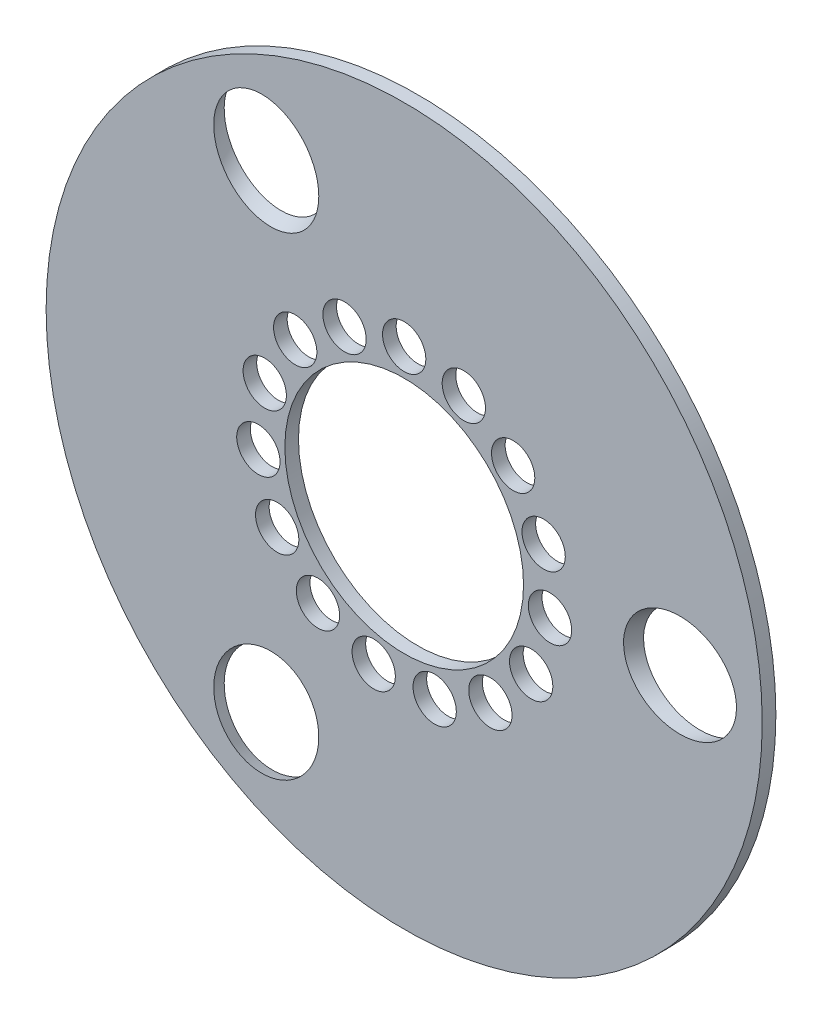
from build123d import *

# Parameters (mm, degrees)
SKETCH1_R           = 52.5
BOSS_EXTRUDE2_DEPTH = 2
SKETCH4_R           = 3.175
CUT_EXTRUDE2_DEPTH  = 2
SKETCH5_R           = 7.5
CUT_EXTRUDE3_DEPTH  = 102
SKETCH6_R           = 7.5
CUT_EXTRUDE4_DEPTH  = 102
SKETCH7_R           = 7.5
CUT_EXTRUDE5_DEPTH  = 102
SKETCH8_R           = 17.5
CUT_EXTRUDE6_DEPTH  = 10


with BuildPart() as part:
    # Sketch1 → Boss-Extrude2 (new body)
    with BuildSketch(Plane.XY):
        Circle(SKETCH1_R)
    extrude(amount=BOSS_EXTRUDE2_DEPTH)

    # Sketch4 → Cut-Extrude2 (cut)
    with BuildSketch(Plane.XY):
        with Locations((0, 21.5)):
            Circle(SKETCH4_R)
        with Locations((8.744837826, 19.641227339)):
            Circle(SKETCH4_R)
        with Locations((15.977613748, 14.386308037)):
            Circle(SKETCH4_R)
        with Locations((20.4477151, 6.643865379)):
            Circle(SKETCH4_R)
        with Locations((21.38222075, -2.24736196)):
            Circle(SKETCH4_R)
        with Locations((18.619546181, -10.75)):
            Circle(SKETCH4_R)
        with Locations((12.637382924, -17.393865379)):
            Circle(SKETCH4_R)
        with Locations((4.470101353, -21.030173416)):
            Circle(SKETCH4_R)
        with Locations((-4.470101353, -21.030173416)):
            Circle(SKETCH4_R)
        with Locations((-12.637382924, -17.393865379)):
            Circle(SKETCH4_R)
        with Locations((-18.619546181, -10.75)):
            Circle(SKETCH4_R)
        with Locations((-21.38222075, -2.24736196)):
            Circle(SKETCH4_R)
        with Locations((-20.4477151, 6.643865379)):
            Circle(SKETCH4_R)
        with Locations((-15.977613748, 14.386308037)):
            Circle(SKETCH4_R)
        with Locations((-8.744837826, 19.641227339)):
            Circle(SKETCH4_R)
    extrude(amount=CUT_EXTRUDE2_DEPTH, mode=Mode.SUBTRACT)

    # Sketch5 → Cut-Extrude3 (cut)
    with BuildSketch(Plane(origin=(-10.124934849, 0, 21.712992854), x_dir=(0, -1, 0), z_dir=(-0.4226182617407003, 0, 0.9063077870366496))):
        with Locations(Location((0, 37.5, 0), (0, 0, 270))):
            Circle(SKETCH5_R)
    extrude(amount=-CUT_EXTRUDE3_DEPTH, mode=Mode.SUBTRACT)

    # Sketch6 → Cut-Extrude4 (cut)
    with BuildSketch(Plane(origin=(6.212874781, 10.761014782, 26.647105929), x_dir=(0.86602540378444, -0.4999999999999977, 0), z_dir=(-0.21130913087034603, -0.36599815077066267, -0.9063077870366526))):
        with Locations(Location((0, 37.5, 0), (0, 0, 270))):
            Circle(SKETCH6_R)
    extrude(amount=CUT_EXTRUDE4_DEPTH, mode=Mode.SUBTRACT)

    # Sketch7 → Cut-Extrude5 (cut)
    with BuildSketch(Plane(origin=(6.212874781, -10.761014782, 26.647105929), x_dir=(0.8660254037844399, 0.4999999999999978, 0), z_dir=(0.2113091308703492, -0.36599815077066805, 0.9063077870366496))):
        with Locations(Location((0, 37.5, 0), (0, 0, 270))):
            Circle(SKETCH7_R)
    extrude(amount=-CUT_EXTRUDE5_DEPTH, mode=Mode.SUBTRACT)

    # Sketch8 → Cut-Extrude6 (cut)
    with BuildSketch(Plane.XY):
        Circle(SKETCH8_R)
    extrude(amount=CUT_EXTRUDE6_DEPTH, mode=Mode.SUBTRACT)


solid = part.part
